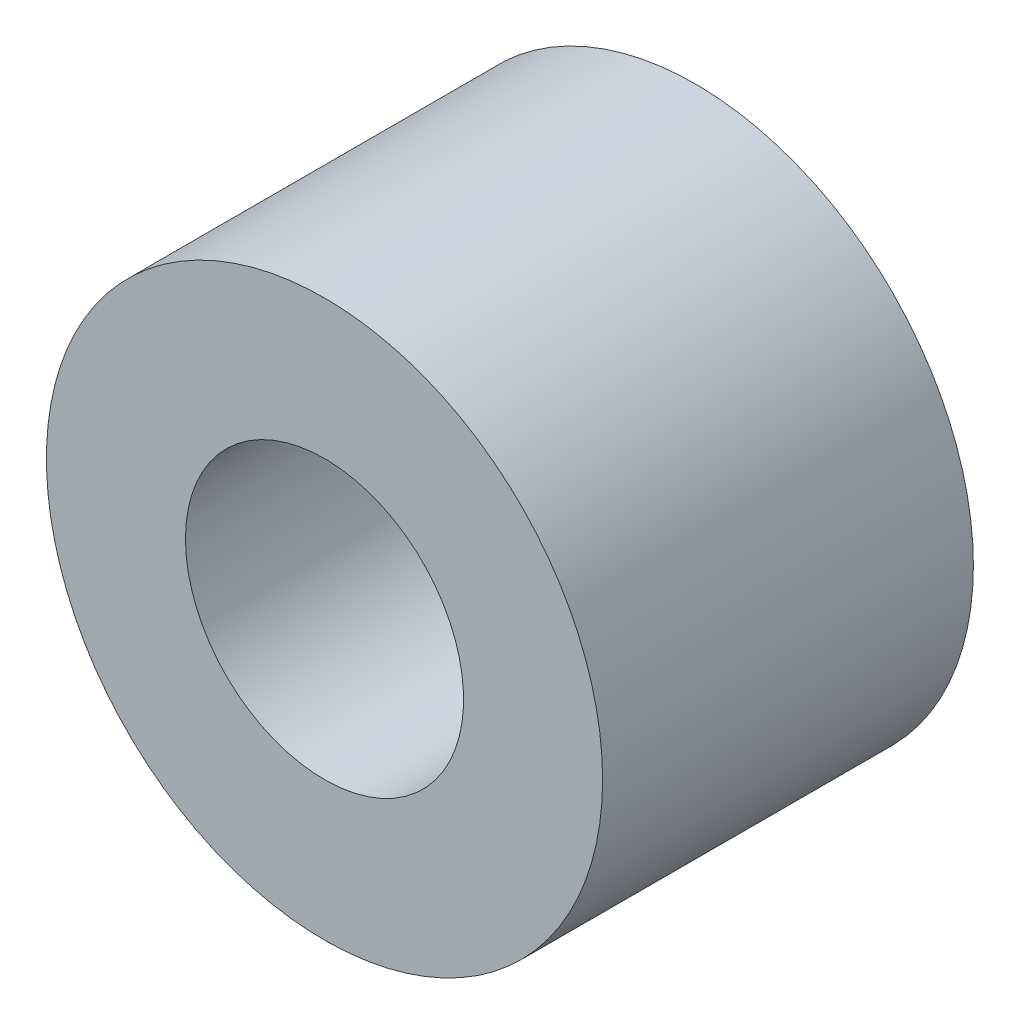
from build123d import *

# Parameters (mm, degrees)
ESQUISSE1_R             = 3
BOSS_EXTRU_1_DEPTH      = 4
ESQUISSE2_R             = 1.5
ENL_V_MAT_EXTRU_1_DEPTH = 4


with BuildPart() as part:
    # Esquisse1 → Boss.-Extru.1 (new body)
    with BuildSketch(Plane.XY):
        Circle(ESQUISSE1_R)
    extrude(amount=BOSS_EXTRU_1_DEPTH)

    # Esquisse2 → Enlèv. mat.-Extru.1 (cut)
    with BuildSketch(Plane(origin=(0, 0, 0), x_dir=(-1, 0, 0), z_dir=(0, 0, -1))):
        Circle(ESQUISSE2_R)
    extrude(amount=-ENL_V_MAT_EXTRU_1_DEPTH, mode=Mode.SUBTRACT)


solid = part.part
